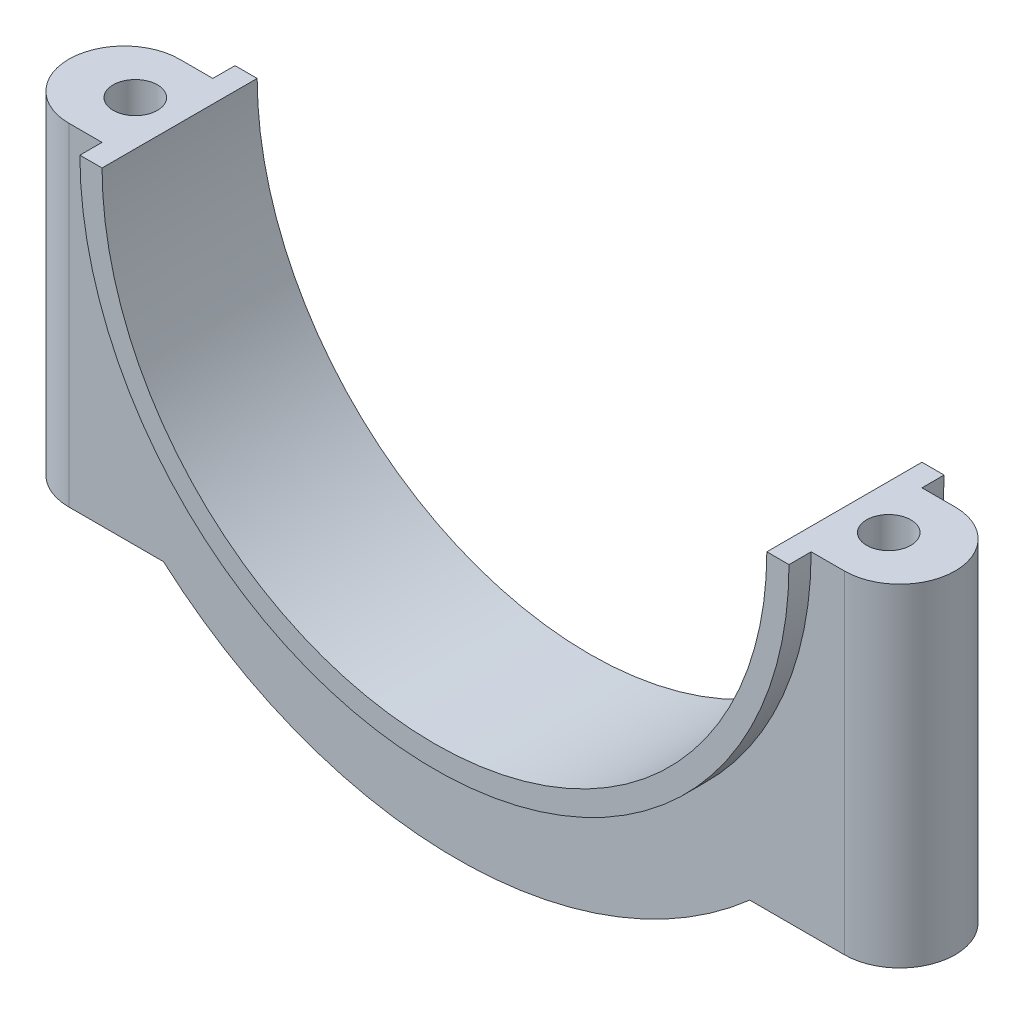
from build123d import *

# Parameters (mm, degrees)
BOSS_EXTRUDE1_DEPTH = 5
BOSS_EXTRUDE2_DEPTH = 1
FILLET1_RADIUS      = 2.5
FILLET1_LENGTH      = 15
FILLET2_RADIUS      = 2.5
FILLET2_LENGTH      = 15
BOSS_EXTRUDE3_START = -6
BOSS_EXTRUDE3_DEPTH = 6
SKETCH5_R           = 1
CUT_EXTRUDE2_DEPTH  = 15


with BuildPart() as part:
    # Sketch2 → Boss-Extrude1 (new body)
    with BuildSketch(Plane.XY):
        with BuildLine():
            Line((-20, 15), (-20, 0))
            Line((-20, 0), (-13.228756555, 0))
            ThreePointArc((-13.228756555, 0), (0, -5), (13.228756555, 0))
            Line((13.228756555, 0), (20, 0))
            Line((20, 0), (20, 15))
            Line((20, 15), (15, 15))
            ThreePointArc((15, 15), (0, 0), (-15, 15))
            Line((-15, 15), (-20, 15))
        make_face()
    extrude(amount=BOSS_EXTRUDE1_DEPTH)

    # Sketch3 → Boss-Extrude2 (add)
    with BuildSketch(Plane.XY.offset(5)):
        with BuildLine():
            Line((-16, 15), (-15, 15))
            ThreePointArc((-15, 15), (0, 0), (15, 15))
            Line((15, 15), (16, 15))
            ThreePointArc((16, 15), (0, -1), (-16, 15))
        make_face()
    extrude(amount=BOSS_EXTRUDE2_DEPTH)

    # Fillet1: full round fillet: the end face becomes a half cylinder, R = half its width
    fillet1_face = Plane((20, 7.5, 2.5), x_dir=(0, -1, 0), z_dir=(1, 0, 0))  # on the end face: x along it, z out of the body
    fillet1_slab = fillet1_face.offset(-FILLET1_RADIUS / 2) * Box(FILLET1_LENGTH, 2 * FILLET1_RADIUS, FILLET1_RADIUS, mode=Mode.PRIVATE)  # the body's end, R deep
    fillet1_round = Plane((17.5, 7.5, 2.5), x_dir=(1, 0, 0), z_dir=(0, -1, 0)) * Cylinder(FILLET1_RADIUS, FILLET1_LENGTH, mode=Mode.PRIVATE)  # its axis R under the face
    add(fillet1_slab - fillet1_round, mode=Mode.SUBTRACT)

    # Fillet2: full round fillet: the end face becomes a half cylinder, R = half its width
    fillet2_face = Plane((-20, 7.5, 2.5), x_dir=(0, -1, 0), z_dir=(-1, 0, 0))  # on the end face: x along it, z out of the body
    fillet2_slab = fillet2_face.offset(-FILLET2_RADIUS / 2) * Box(FILLET2_LENGTH, 2 * FILLET2_RADIUS, FILLET2_RADIUS, mode=Mode.PRIVATE)  # the body's end, R deep
    fillet2_round = Plane((-17.5, 7.5, 2.5), x_dir=(-1, 0, 0), z_dir=(0, -1, 0)) * Cylinder(FILLET2_RADIUS, FILLET2_LENGTH, mode=Mode.PRIVATE)  # its axis R under the face
    add(fillet2_slab - fillet2_round, mode=Mode.SUBTRACT)

    # Sketch3<2> → Boss-Extrude3 (add)
    with BuildSketch(Plane.XY.offset(5).offset(BOSS_EXTRUDE3_START)):
        with BuildLine():
            Line((-16, 15), (-15, 15))
            ThreePointArc((-15, 15), (0, 0), (15, 15))
            Line((15, 15), (16, 15))
            ThreePointArc((16, 15), (0, -1), (-16, 15))
        make_face()
    extrude(amount=BOSS_EXTRUDE3_DEPTH)

    # Sketch5 → Cut-Extrude2 (cut)
    with BuildSketch(Plane(origin=(0, 15, 0), x_dir=(1, 0, 0), z_dir=(0, 1, 0))):
        with Locations(Location((-17, -2.5, 0), (0, 0, 270))):
            Circle(SKETCH5_R)
        with Locations(Location((17, -2.5, 0), (0, 0, 270))):
            Circle(SKETCH5_R)
    extrude(amount=-CUT_EXTRUDE2_DEPTH, mode=Mode.SUBTRACT)


solid = part.part
